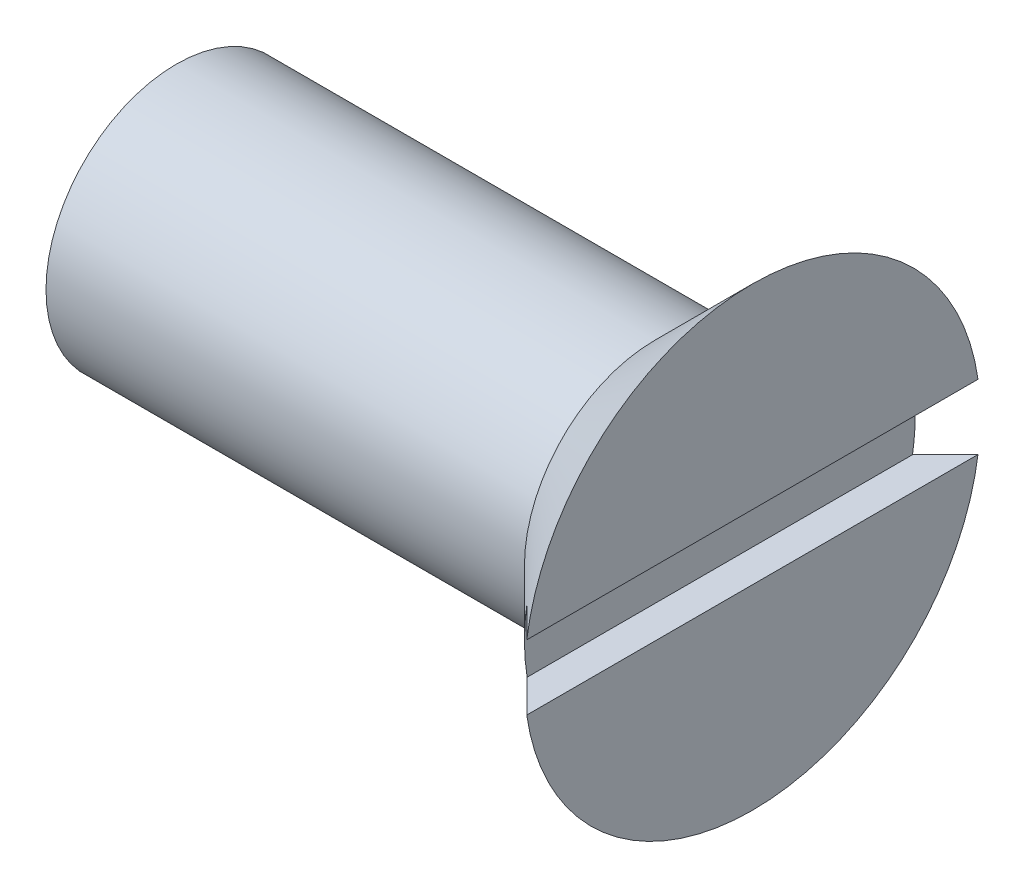
from build123d import *

# Parameters (mm, degrees)
SKETCH2_W          = 16.237911894
SKETCH2_H          = 2
CUT_EXTRUDE1_DEPTH = 1


with BuildPart() as part:
    # Sketch1 → Revolve1 (revolve)
    with BuildSketch(Plane(origin=(0, 0, 0), x_dir=(1, 0, 0), z_dir=(0, 1, 0)), mode=Mode.PRIVATE) as revolve1_sk:
        Polygon((-20, 0), (-17.690598923, -4), (-3, -4), (0, -7), (0, 0), align=None)
    revolve(revolve1_sk.sketch.rotate(Axis((0, 0, 0), (-1, 0, 0)), 180), axis=Axis((0, 0, 0), (-1, 0, 0)))

    # Sketch2 → Cut-Extrude1 (cut)
    with BuildSketch(Plane(origin=(0, 0, 0), x_dir=(0, 0, -1), z_dir=(1, 0, 0))):
        Rectangle(SKETCH2_W, SKETCH2_H)
    extrude(amount=-CUT_EXTRUDE1_DEPTH, mode=Mode.SUBTRACT)


solid = part.part
